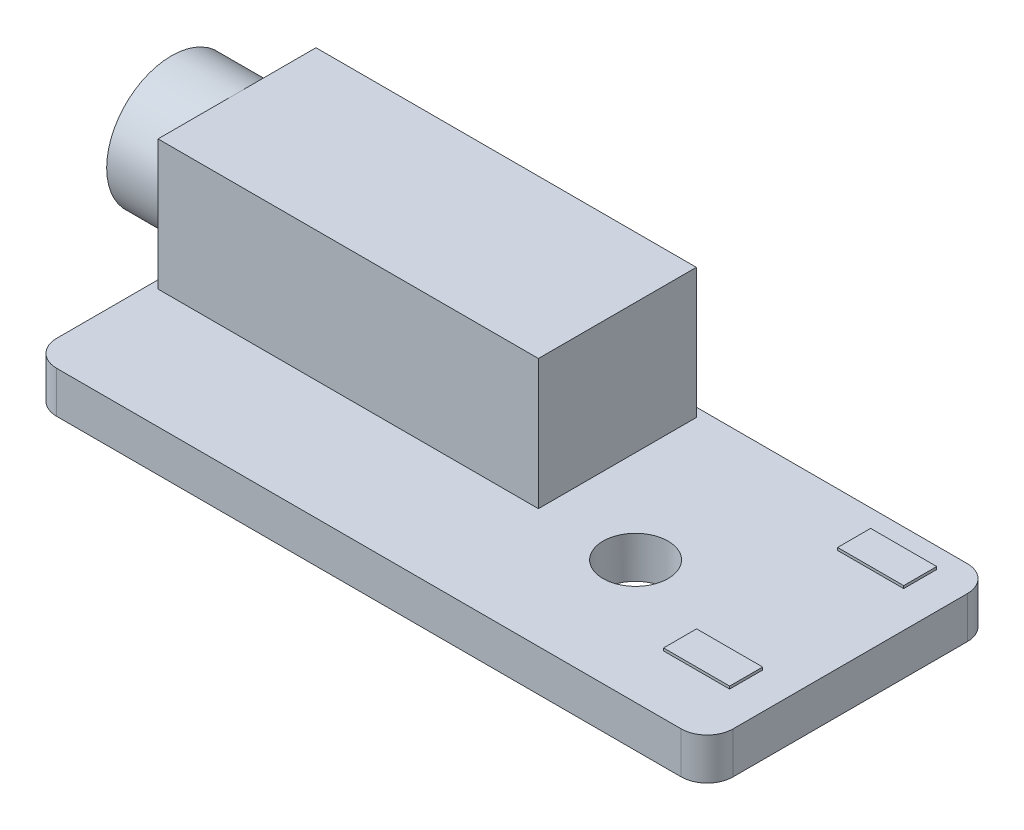
from build123d import *

# Parameters (mm, degrees)
BOSS_EXTRUDE1_DEPTH     = 1.6
SKETCH2_W               = 2.54
SKETCH2_H               = 1.27
BOSS_EXTRUDE2_DEPTH     = 0.1
SKETCH3_W               = 14.62
SKETCH3_H               = 6.07
BOSS_EXTRUDE3_DEPTH     = 5
SKETCH4_R               = 2.49
SKETCH4_R_2             = 1.795
BOSS_EXTRUDE5_DEPTH     = 2.52
CUT_EXTRUDE1_DEPTH      = 17.929090348
CUT_EXTRUDE1_DEPTH_BACK = 17.929090348
SKETCH5_R               = 1.25


with BuildPart() as part:
    # Sketch1 → Boss-Extrude1 (new body)
    with BuildSketch(Plane(origin=(0, 0, 0), x_dir=(1, 0, 0), z_dir=(0, 1, 0))):
        with BuildLine():
            Line((12, 5.5), (-12, 5.5))
            ThreePointArc((-12, 5.5), (-12.707106781, 5.207106781), (-13, 4.5))
            Line((-13, 4.5), (-13, -4.5))
            ThreePointArc((-13, -4.5), (-12.707106781, -5.207106781), (-12, -5.5))
            Line((-12, -5.5), (12, -5.5))
            ThreePointArc((12, -5.5), (12.707106781, -5.207106781), (13, -4.5))
            Line((13, -4.5), (13, 4.5))
            ThreePointArc((13, 4.5), (12.707106781, 5.207106781), (12, 5.5))
        make_face()
    extrude(amount=BOSS_EXTRUDE1_DEPTH)

    # Sketch2 → Boss-Extrude2 (add)
    with BuildSketch(Plane(origin=(0, 1.6, 0), x_dir=(1, 0, 0), z_dir=(0, 1, 0))):
        with Locations((10.34, 4.08)):
            Rectangle(SKETCH2_W, SKETCH2_H)
        with Locations((10.34, -2.61)):
            Rectangle(SKETCH2_W, SKETCH2_H)
    extrude(amount=BOSS_EXTRUDE2_DEPTH)

    # Sketch3 → Boss-Extrude3 (add)
    with BuildSketch(Plane(origin=(0, 1.6, 0), x_dir=(1, 0, 0), z_dir=(0, 1, 0))):
        with Locations((-5.38, 2.12)):
            Rectangle(SKETCH3_W, SKETCH3_H)
    extrude(amount=BOSS_EXTRUDE3_DEPTH)

    # Sketch4 → Boss-Extrude5 (add)
    with BuildSketch(Plane.ZY.offset(12.69)):
        with Locations(Location((-2.12, 4.1, 0), (0, 0, 180))):
            Circle(SKETCH4_R)
        with Locations((-2.12, 4.1)):
            Circle(SKETCH4_R_2, mode=Mode.SUBTRACT)
    extrude(amount=BOSS_EXTRUDE5_DEPTH)

    # Sketch5 → Cut-Extrude1 (cut, two sides: drawn at the far end of the back side and taken through both)
    with BuildSketch(Plane(origin=(0, 1.6, 0), x_dir=(1, 0, 0), z_dir=(0, 1, 0)).offset(-CUT_EXTRUDE1_DEPTH_BACK)):
        with Locations(Location((5.5, -0.75, 0), (0, 0, 270))):
            Circle(SKETCH5_R)
    extrude(amount=CUT_EXTRUDE1_DEPTH + CUT_EXTRUDE1_DEPTH_BACK, mode=Mode.SUBTRACT)


solid = part.part
